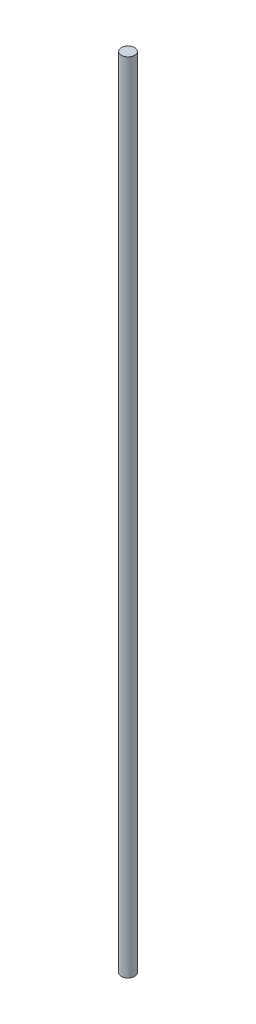
from build123d import *

# Parameters (mm, degrees)
SKETCH_1_R      = 0.1
EXTRUDE_1_DEPTH = 12


with BuildPart() as part:
    # Эскиз1 → Бобышка-Вытянуть1 (new body)
    with BuildSketch(Plane(origin=(0, 0, 0), x_dir=(1, 0, 0), z_dir=(0, 1, 0))):
        with Locations(Location((0, 0, 0), (0, 0, 270))):
            Circle(SKETCH_1_R)
    extrude(amount=EXTRUDE_1_DEPTH)


solid = part.part
